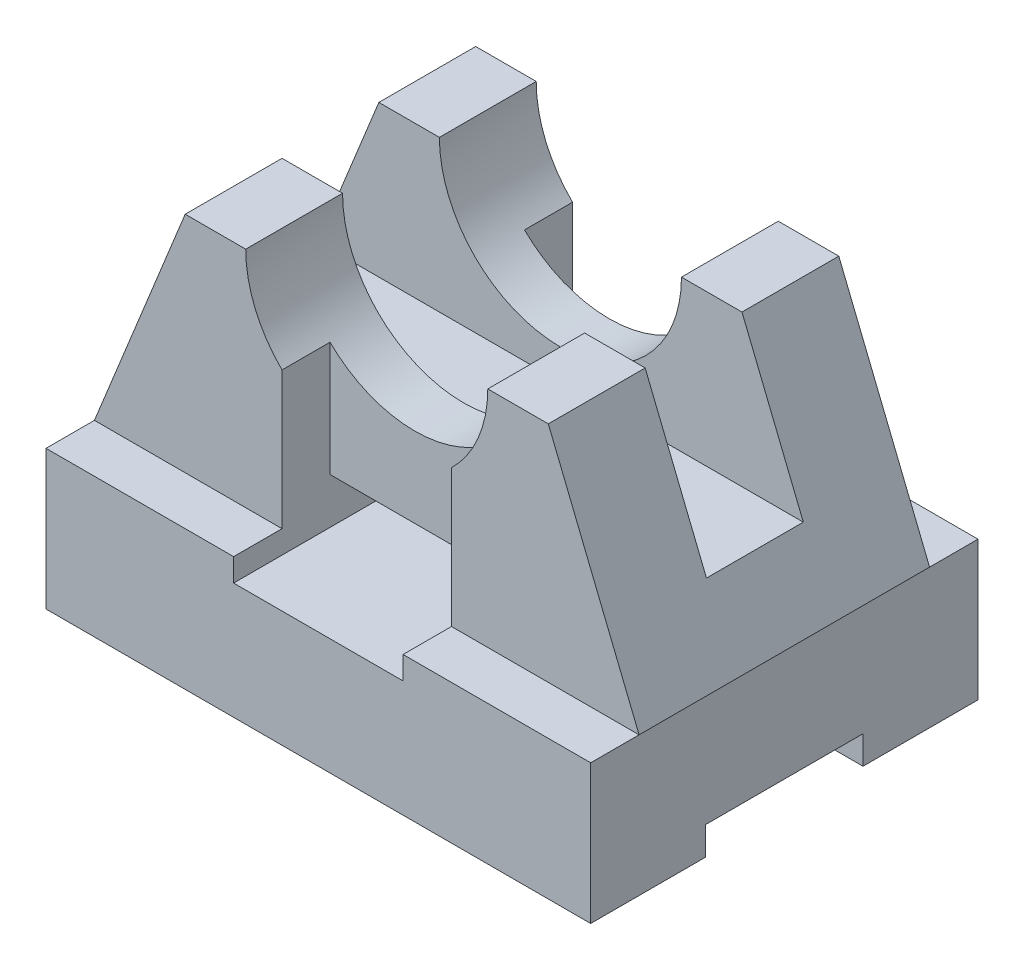
from build123d import *

# Parameters (mm, degrees)
SKETCH1_W               = 90
SKETCH1_H               = 64
BOSS_EXTRUDE1_DEPTH     = 23
SKETCH3_W               = 26
SKETCH3_H               = 9.317565448
CUT_EXTRUDE1_DEPTH      = 99.249681933
SKETCH4_W               = 28
SKETCH4_H               = 7.570604484
CUT_EXTRUDE2_DEPTH      = 82.547532152
BOSS_EXTRUDE2_DEPTH     = 64
CUT_EXTRUDE3_DEPTH      = 113.800709218
CUT_EXTRUDE3_DEPTH_BACK = 113.800709218
SKETCH7_W               = 8
SKETCH7_H               = 37
CUT_EXTRUDE4_DEPTH      = 113.800709218
CUT_EXTRUDE4_DEPTH_BACK = 113.800709218
SKETCH8_W               = 16
SKETCH8_H               = 25
CUT_EXTRUDE5_DEPTH      = 94.600213675
CUT_EXTRUDE5_DEPTH_BACK = 94.600213675
SKETCH9_R               = 20
SKETCH11_W              = 28
SKETCH11_H              = 15.933340455
CUT_EXTRUDE6_DEPTH      = 69.647220475


with BuildPart() as part:
    # Sketch1 → Boss-Extrude1 (new body)
    with BuildSketch(Plane(origin=(0, 0, 0), x_dir=(1, 0, 0), z_dir=(0, 1, 0))):
        Rectangle(SKETCH1_W, SKETCH1_H)
    extrude(amount=BOSS_EXTRUDE1_DEPTH)

    # Sketch3 → Cut-Extrude1 (cut, through all)
    with BuildSketch(Plane.ZY.offset(45)):
        Rectangle(SKETCH3_W, SKETCH3_H)
    extrude(amount=-CUT_EXTRUDE1_DEPTH, mode=Mode.SUBTRACT)

    # Sketch4 → Cut-Extrude2 (cut, through all)
    with BuildSketch(Plane.XY.offset(32)):
        with Locations((0, 23)):
            Rectangle(SKETCH4_W, SKETCH4_H)
    cut_extrude2 = extrude(amount=-CUT_EXTRUDE2_DEPTH, mode=Mode.SUBTRACT)

    # Sketch5 → Boss-Extrude2 (add, through all)
    with BuildSketch(Plane.XY.offset(32)):
        Polygon((-30, 60), (30, 60), (45, 23), (-45, 23), align=None)
    extrude(amount=-BOSS_EXTRUDE2_DEPTH)

    # Sketch7 → Cut-Extrude3 (cut, two sides: drawn at the far end of the back side and taken through both)
    with BuildSketch(Plane.ZY.offset(45).offset(-CUT_EXTRUDE3_DEPTH_BACK)):
        with Locations((-28, 41.5)):
            Rectangle(SKETCH7_W, SKETCH7_H)
        with Locations((28, 41.5)):
            Rectangle(SKETCH7_W, SKETCH7_H)
    extrude(amount=CUT_EXTRUDE3_DEPTH + CUT_EXTRUDE3_DEPTH_BACK, mode=Mode.SUBTRACT)

    # Sketch8 → Cut-Extrude4 (cut, two sides: drawn at the far end of the back side and taken through both)
    with BuildSketch(Plane.ZY.offset(45).offset(-CUT_EXTRUDE4_DEPTH_BACK)):
        with Locations((0, 47.5)):
            Rectangle(SKETCH8_W, SKETCH8_H)
    extrude(amount=CUT_EXTRUDE4_DEPTH + CUT_EXTRUDE4_DEPTH_BACK, mode=Mode.SUBTRACT)

    # Sketch9 → Cut-Extrude5 (cut, two sides: drawn at the far end of the back side and taken through both)
    with BuildSketch(Plane.XY.offset(24).offset(-CUT_EXTRUDE5_DEPTH_BACK)):
        with Locations((0, 60)):
            Circle(SKETCH9_R)
    extrude(amount=CUT_EXTRUDE5_DEPTH + CUT_EXTRUDE5_DEPTH_BACK, mode=Mode.SUBTRACT)

    # Sketch11 → Cut-Extrude6 (cut, through all)
    with BuildSketch(Plane(origin=(0, 19.214697758, 0), x_dir=(1, 0, 0), z_dir=(0, 1, 0))):
        with Locations((0, -24.033329773)):
            Rectangle(SKETCH11_W, SKETCH11_H)
    cut_extrude6 = extrude(amount=CUT_EXTRUDE6_DEPTH, mode=Mode.SUBTRACT)

    # Mirror1: Cut-Extrude2, Cut-Extrude6 across plane
    add(cut_extrude2.mirror(Plane.XY), mode=Mode.SUBTRACT)
    add(cut_extrude6.mirror(Plane.XY), mode=Mode.SUBTRACT)


solid = part.part
